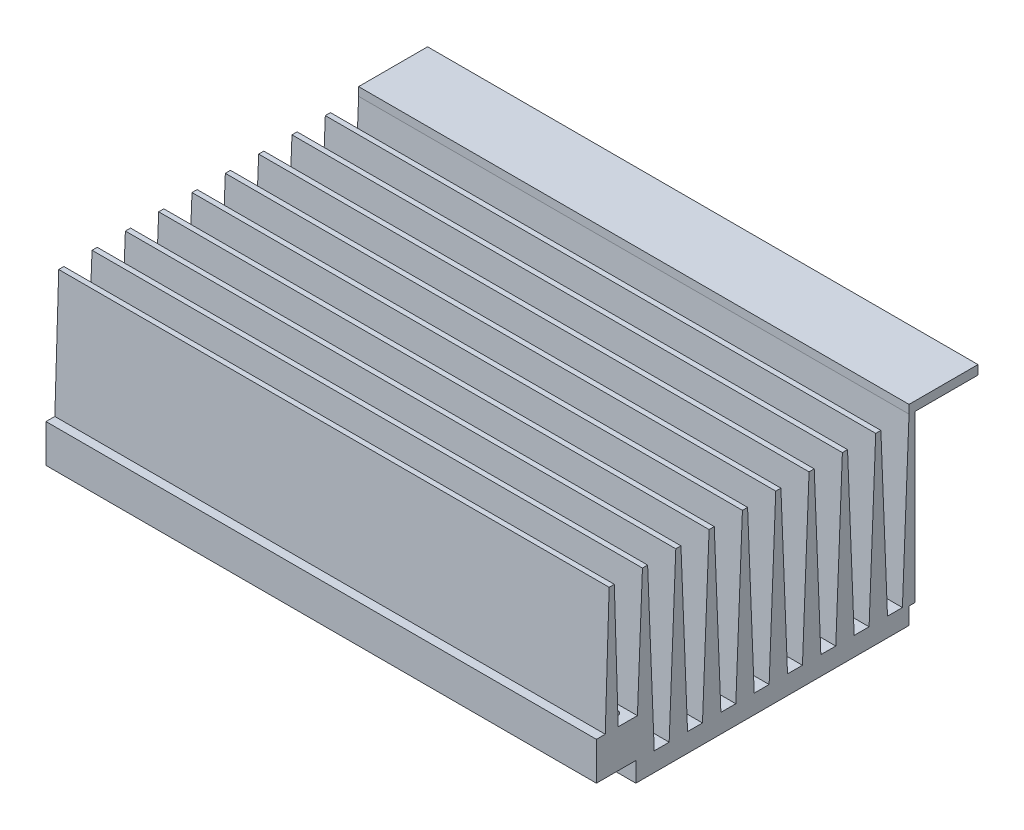
from build123d import *

# Parameters (mm, degrees)
SKETCH1_W               = 195.4375
SKETCH1_H               = 97
BOSS_EXTRUDE1_DEPTH     = 65
CUT_EXTRUDE1_DEPTH      = 228.661626996
SKETCH4_W               = 195.4375
SKETCH4_H               = 15
BOSS_EXTRUDE2_DEPTH     = 13.5
BOSS_EXTRUDE3_DEPTH     = 195.4375
SKETCH6_W               = 195.4375
SKETCH6_H               = 2.19
BOSS_EXTRUDE4_DEPTH     = 62
SKETCH7_W               = 195.4375
SKETCH7_H               = 3.24
BOSS_EXTRUDE5_DEPTH     = 22.3
CUT_EXTRUDE2_DEPTH      = 239.145599385
CUT_EXTRUDE2_DEPTH_BACK = 239.145599385
SKETCH8_R               = 1.5


with BuildPart() as part:
    # Sketch1 → Boss-Extrude1 (new body)
    with BuildSketch(Plane(origin=(0, 0, 0), x_dir=(1, 0, 0), z_dir=(0, 1, 0))):
        with Locations((97.71875, 48.5)):
            Rectangle(SKETCH1_W, SKETCH1_H)
    extrude(amount=BOSS_EXTRUDE1_DEPTH)

    # Sketch2 → Cut-Extrude1 (cut, through all)
    with BuildSketch(Plane.ZY):
        Polygon((-97, 65), (-94.65, 6.7), (-89.35, 6.7), (-87, 65), align=None)
        Polygon((-75.16875, 65), (-85.16875, 65), (-82.81875, 6.7), (-77.51875, 6.7), align=None)
        Polygon((-63.3375, 65), (-73.3375, 65), (-70.9875, 6.7), (-65.6875, 6.7), align=None)
        Polygon((-51.50625, 65), (-61.50625, 65), (-59.15625, 6.7), (-53.85625, 6.7), align=None)
        Polygon((-39.675, 65), (-49.675, 65), (-47.325, 6.7), (-42.025, 6.7), align=None)
        Polygon((-27.84375, 65), (-37.84375, 65), (-35.49375, 6.7), (-30.19375, 6.7), align=None)
        Polygon((-16.0125, 65), (-26.0125, 65), (-23.6625, 6.7), (-18.3625, 6.7), align=None)
        Polygon((-4.18125, 65), (-14.18125, 65), (-11.83125, 6.7), (-6.53125, 6.7), align=None)
        Polygon((7.65, 65), (-2.35, 65), (0, 6.7), (5.3, 6.7), align=None)
    extrude(amount=-CUT_EXTRUDE1_DEPTH, mode=Mode.SUBTRACT)

    # Sketch4 → Boss-Extrude2 (add)
    with BuildSketch(Plane(origin=(0, 7, 0), x_dir=(-1, 0, 0), z_dir=(0, -1, 0))):
        with Locations((-97.71875, -6.5)):
            Rectangle(SKETCH4_W, SKETCH4_H)
    extrude(amount=-BOSS_EXTRUDE2_DEPTH)

    # Sketch5 → Boss-Extrude3 (add)
    with BuildSketch(Plane.ZY):
        Polygon((6.265625, 20.5), (7.65, 65), (9.48125, 65), (10.865625, 20.5), align=None)
    extrude(amount=-BOSS_EXTRUDE3_DEPTH)

    # Sketch6 → Boss-Extrude4 (add)
    with BuildSketch(Plane(origin=(0, 6, 0), x_dir=(-1, 0, 0), z_dir=(0, -1, 0))):
        with Locations((-97.71875, 98.095)):
            Rectangle(SKETCH6_W, SKETCH6_H)
    extrude(amount=-BOSS_EXTRUDE4_DEPTH)

    # Sketch7 → Boss-Extrude5 (add)
    with BuildSketch(Plane(origin=(0, 0, -99.19), x_dir=(-1, 0, 0), z_dir=(0, 0, -1))):
        with Locations((-97.71875, 66.38)):
            Rectangle(SKETCH7_W, SKETCH7_H)
    extrude(amount=BOSS_EXTRUDE5_DEPTH)

    # Sketch8 → Cut-Extrude2 (cut, two sides: drawn at the far end of the back side and taken through both)
    with BuildSketch(Plane(origin=(0, 6.7, 0), x_dir=(1, 0, 0), z_dir=(0, 1, 0)).offset(-CUT_EXTRUDE2_DEPTH_BACK)):
        with Locations(Location((190.4375, 92, 0), (0, 0, 270))):
            Circle(SKETCH8_R)
        with Locations(Location((190.4375, -2.85468214, 0), (0, 0, 270))):
            Circle(SKETCH8_R)
        with Locations(Location((5, 92, 0), (0, 0, 90))):
            Circle(SKETCH8_R)
        with Locations(Location((5, -2.85468214, 0), (0, 0, 270))):
            Circle(SKETCH8_R)
    extrude(amount=CUT_EXTRUDE2_DEPTH + CUT_EXTRUDE2_DEPTH_BACK, mode=Mode.SUBTRACT)


solid = part.part
